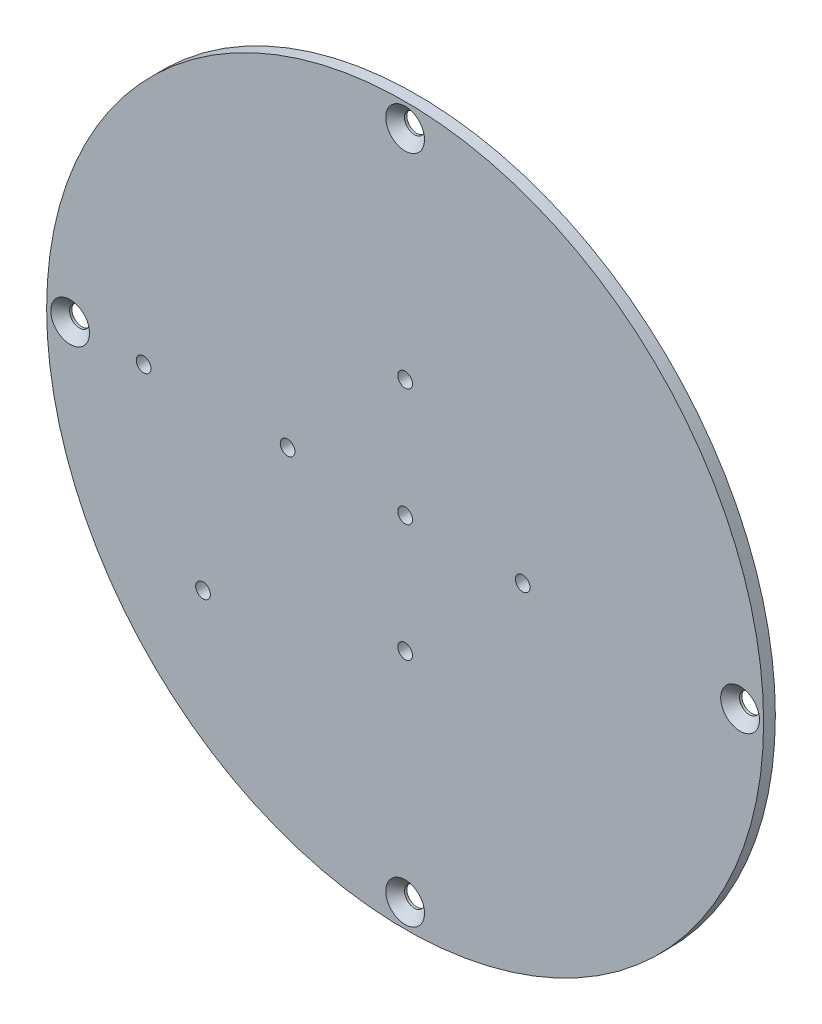
from build123d import *

# Parameters (mm, degrees)
SKETCH_1_R               = 61
EXTRUDE_1_DEPTH          = 2
PATTERN_CIRCULAR_1_COUNT = 4
HOLE_WIZARD_M3_1_D       = 2.5
PATTERN_CIRCULAR_2_COUNT = 4
HOLE_WIZARD_M3_2_D       = 2.5
HOLE_WIZARD_M3_3_D       = 2.5


with BuildPart() as part:
    # 草图1 → 凸台-拉伸1 (new body)
    with BuildSketch(Plane.XY):
        Circle(SKETCH_1_R)
    extrude(amount=EXTRUDE_1_DEPTH)

    # 草图3 → 打孔尺寸(%根据十字)槽半沉头木螺钉的类型1 (revolve, cut)
    with BuildSketch(Plane(origin=(0, 57, 2), x_dir=(0, -1, 0), z_dir=(1, 0, 0))):
        Polygon((0, 0), (0, 2), (1.7, 2), (1.7, 1.6), (3.3, 0), align=None)
    hole_wizard_1 = revolve(axis=Axis((0, 57, 8.35), (0, 0, -1)), mode=Mode.SUBTRACT)

    # 阵列(圆周)1: 打孔尺寸(%根据十字)槽半沉头木螺钉的类型1 ×4 about axis
    pattern_circular_1_axis = Axis((0, 0, 0), (0, 0, 1))
    for i in range(1, PATTERN_CIRCULAR_1_COUNT):
        add(hole_wizard_1.rotate(pattern_circular_1_axis, i * 360 / PATTERN_CIRCULAR_1_COUNT), mode=Mode.SUBTRACT)

    # M3 螺纹孔1 (through all)
    with Locations(Plane(origin=(0, 0, 0), x_dir=(-1, 0, 0), z_dir=(0, 0, -1))):
        with Locations((-20, 0)):
            hole_wizard_m3_1 = Hole(HOLE_WIZARD_M3_1_D / 2)

    # 阵列(圆周)2: M3 螺纹孔1 ×4 about axis
    pattern_circular_2_axis = Axis((0, 0, 0), (0, 0, 1))
    for i in range(1, PATTERN_CIRCULAR_2_COUNT):
        add(hole_wizard_m3_1.rotate(pattern_circular_2_axis, i * 360 / PATTERN_CIRCULAR_2_COUNT), mode=Mode.SUBTRACT)

    # M3 螺纹孔2 (through all)
    with Locations(Plane(origin=(0, 0, 0), x_dir=(-1, 0, 0), z_dir=(0, 0, -1))):
        with Locations((0, 0)):
            Hole(HOLE_WIZARD_M3_2_D / 2)

    # M3 螺纹孔3 (through all)
    with Locations(Plane(origin=(0, 0, 0), x_dir=(-1, 0, 0), z_dir=(0, 0, -1))):
        with Locations((34.387640449, -28.244294722), (44.5, 0)):
            Hole(HOLE_WIZARD_M3_3_D / 2)


solid = part.part
